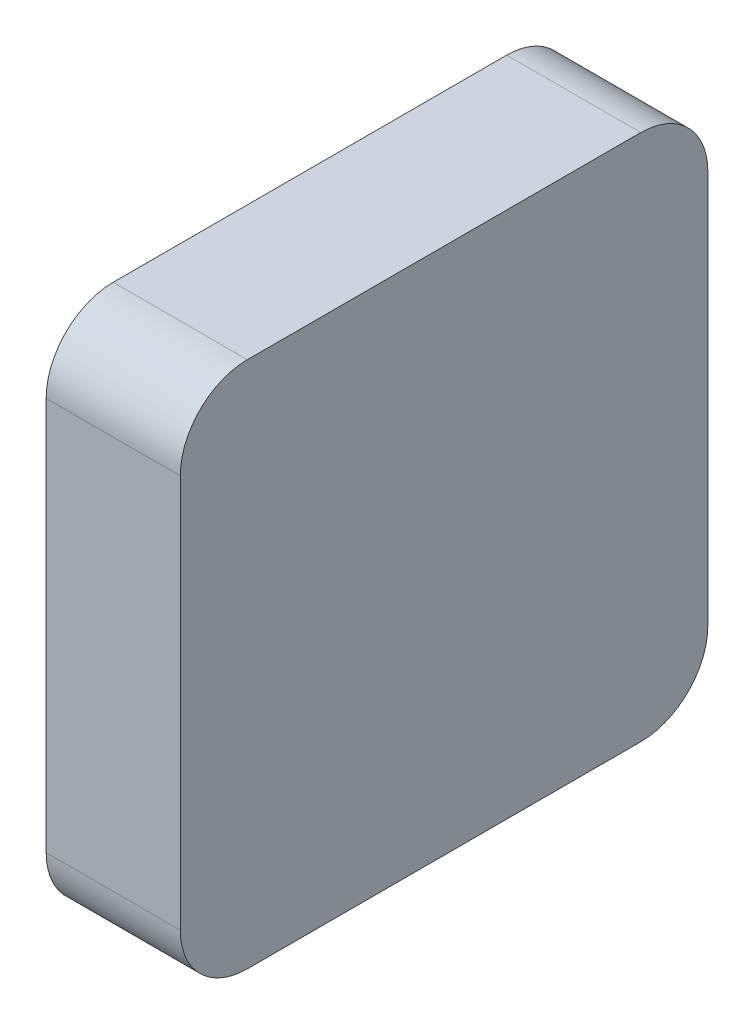
from build123d import *

# Parameters (mm, degrees)
BOSS_EXTRUDE1_DEPTH = 7.62


with BuildPart() as part:
    # Sketch1 → Boss-Extrude1 (new body)
    with BuildSketch(Plane.YZ):
        with BuildLine():
            Line((-11.176, -14.986), (11.176, -14.986))
            ThreePointArc((11.176, -14.986), (13.870076836, -13.870076836), (14.986, -11.176))
            Line((14.986, -11.176), (14.986, 11.176))
            ThreePointArc((14.986, 11.176), (13.870076836, 13.870076836), (11.176, 14.986))
            Line((11.176, 14.986), (-11.176, 14.986))
            ThreePointArc((-11.176, 14.986), (-13.870076836, 13.870076836), (-14.986, 11.176))
            Line((-14.986, 11.176), (-14.986, -11.176))
            ThreePointArc((-14.986, -11.176), (-13.870076836, -13.870076836), (-11.176, -14.986))
        make_face()
    extrude(amount=BOSS_EXTRUDE1_DEPTH)


solid = part.part
